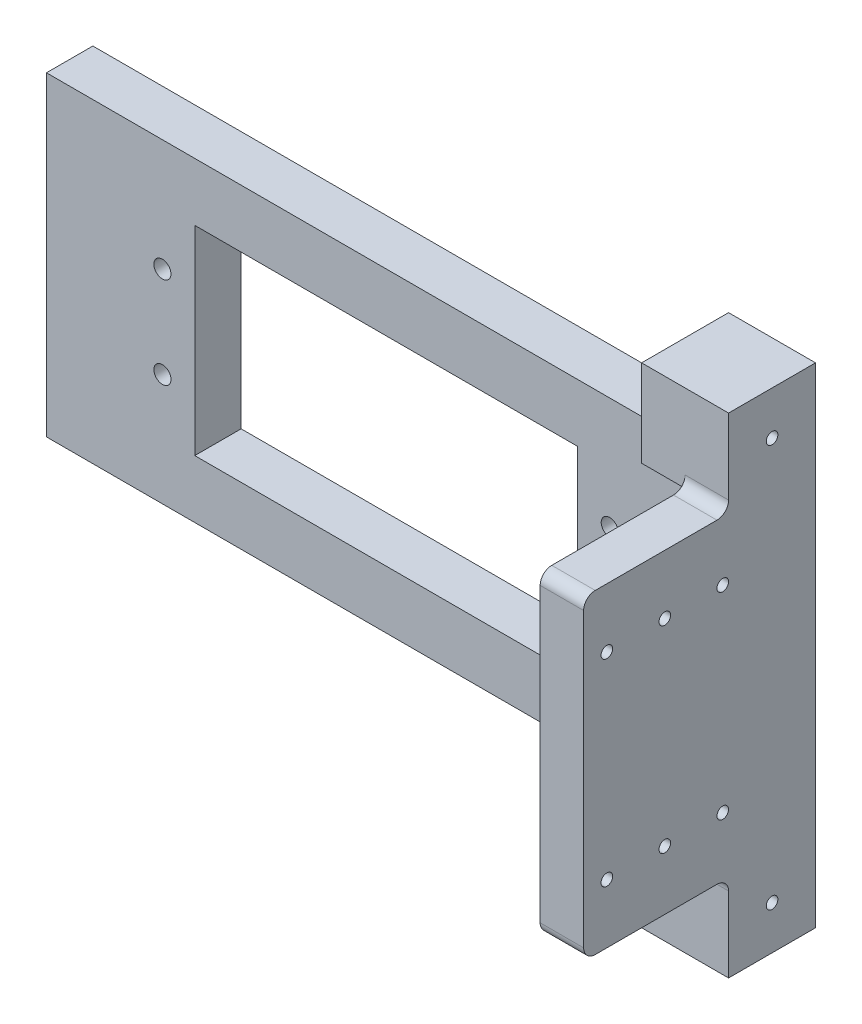
from build123d import *

# Parameters (mm, degrees)
SKETCH1_W            = 54.61
SKETCH1_H            = 47.244
SKETCH1_W_2          = 41.91
SKETCH1_H_2          = 21.844
BOSS_EXTRUDE1_DEPTH  = 5.08
SKETCH2_R            = 0.93599
CUT_EXTRUDE1_DEPTH   = 73.388217522
SKETCH10_W           = 14.41958
SKETCH10_H           = 19.49958
SKETCH10_R           = 0.635
BOSS_EXTRUDE4_DEPTH  = 5.08
SKETCH11_R           = 0.635
SKETCH11_W           = 3.302
SKETCH11_H           = 76.2
BOSS_EXTRUDE5_DEPTH  = 5.08
SKETCH12_W           = 60.452
SKETCH12_H           = 6.35
SKETCH12_W_2         = 59.182
CUT_EXTRUDE2_DEPTH   = 95.448366629
SKETCH13_W           = 7.0195552
SKETCH13_H           = 78.993394517
BOSS_EXTRUDE6_DEPTH  = 4.826
FILLET1_R            = 2.54
CUT_EXTRUDE3_DEPTH   = 95.448366629
SKETCH15_W           = 9.078627065
SKETCH15_H           = 34.544
BOSS_EXTRUDE7_DEPTH  = 5.08
SKETCH19_W           = 25.4
SKETCH19_H           = 34.544
BOSS_EXTRUDE9_DEPTH  = 4.7625
SKETCH20_W           = 9.525
SKETCH20_H           = 9.525
BOSS_EXTRUDE10_DEPTH = 9.525
SKETCH21_R           = 0.635
CUT_EXTRUDE4_DEPTH   = 98.23065776
SKETCH22_R           = 0.635
CUT_EXTRUDE5_DEPTH   = 98.23065776
RIB1_REACH           = 80.493
SKETCH24_WALL_W      = 169.76250031
SKETCH24_WALL_H      = 2.54
FILLET2_R            = 1.27


with BuildPart() as part:
    # Sketch1 → Boss-Extrude1 (new body)
    with BuildSketch(Plane.XY):
        with Locations((27.305, 23.622)):
            Rectangle(SKETCH1_W, SKETCH1_H)
        with Locations((27.305, 23.622)):
            Rectangle(SKETCH1_W_2, SKETCH1_H_2, mode=Mode.SUBTRACT)
    extrude(amount=BOSS_EXTRUDE1_DEPTH)

    # Sketch2 → Cut-Extrude1 (cut, through all)
    with BuildSketch(Plane.XY.offset(5.08)):
        with Locations((2.80543, 28.62199)):
            Circle(SKETCH2_R)
        with Locations((2.80543, 18.62201)):
            Circle(SKETCH2_R)
        with Locations((51.80457, 28.62199)):
            Circle(SKETCH2_R)
        with Locations((51.80457, 18.62201)):
            Circle(SKETCH2_R)
    extrude(amount=-CUT_EXTRUDE1_DEPTH, mode=Mode.SUBTRACT)

    # Sketch10 → Boss-Extrude4 (add)
    with BuildSketch(Plane.XY.offset(5.08)):
        with Locations((61.81979, 23.622)):
            Rectangle(SKETCH10_W, SKETCH10_H)
        with Locations((64.35979, 21.49221)):
            Circle(SKETCH10_R, mode=Mode.SUBTRACT)
        with Locations((64.35979, 25.75179)):
            Circle(SKETCH10_R, mode=Mode.SUBTRACT)
    extrude(amount=-BOSS_EXTRUDE4_DEPTH)

    # Sketch11 → Boss-Extrude5 (add)
    with BuildSketch(Plane.XY.offset(5.08)):
        Polygon((0, 47.244), (-5.842, 47.244), (-5.842, 64.262), (-15.748, 64.262), (-15.748, -17.018), (-4.572, -17.018), (-4.572, 0), (0, 0), align=None)
        with Locations(Location((-4.572, 21.49221, 0), (0, 0, 180))):
            Circle(SKETCH11_R, mode=Mode.SUBTRACT)
        with Locations(Location((-4.572, 25.75179, 0), (0, 0, 180))):
            Circle(SKETCH11_R, mode=Mode.SUBTRACT)
        with Locations((-10.795, 23.622)):
            Rectangle(SKETCH11_W, SKETCH11_H, mode=Mode.SUBTRACT)
    extrude(amount=-BOSS_EXTRUDE5_DEPTH)

    # Sketch12 → Cut-Extrude2 (cut, through all)
    with BuildSketch(Plane.XY.offset(5.08)):
        with Locations((24.384, 44.069)):
            Rectangle(SKETCH12_W, SKETCH12_H)
        with Locations((25.019, 3.175)):
            Rectangle(SKETCH12_W_2, SKETCH12_H)
    extrude(amount=-CUT_EXTRUDE2_DEPTH, mode=Mode.SUBTRACT)

    # Sketch13 → Boss-Extrude6 (add)
    with BuildSketch(Plane(origin=(0, 0, 0), x_dir=(-1, 0, 0), z_dir=(0, 0, -1))):
        with Locations((10.665198327, 23.388014827)):
            Rectangle(SKETCH13_W, SKETCH13_H)
    extrude(amount=-BOSS_EXTRUDE6_DEPTH)

    # Fillet1
    fillet1_edges = [part.edges().sort_by_distance(p)[0] for p in [
        (69.02958, 13.87221, 2.54),
        (54.61, 13.87221, 2.54),
        (54.61, 6.35, 2.54),
        (-4.572, 6.35, 2.54),
        (-4.572, -17.018, 2.54),
        (-15.748, -17.018, 2.54),
        (-15.748, 64.262, 2.54),
        (-5.842, 64.262, 2.54),
        (-5.842, 40.894, 2.54),
        (54.61, 40.894, 2.54),
        (54.61, 33.37179, 2.54),
        (69.02958, 33.37179, 2.54),
    ]]
    fillet(fillet1_edges, radius=FILLET1_R)

    # Sketch14 → Cut-Extrude3 (cut, through all)
    with BuildSketch(Plane.XY.offset(5.08)):
        Polygon((2.80543, 40.894), (-0.815942935, 40.894), (-0.815942935, 6.35), (2.80543, 6.35), (2.80543, -19.941776761), (-23.515321153, -19.941776761), (-23.515321153, 65.826532556), (2.80543, 65.826532556), align=None)
        Polygon((51.80457, 40.896870143), (51.80457, 65.826532556), (74.486186006, 65.826532556), (74.486186006, -19.941776761), (51.80457, -19.941776761), (52.07, 6.35), (54.61, 8.89), (54.61, 38.354), align=None)
    extrude(amount=-CUT_EXTRUDE3_DEPTH, mode=Mode.SUBTRACT)

    # Sketch15 → Boss-Extrude7 (add)
    with BuildSketch(Plane.XY.offset(5.08)):
        with Locations((-5.355256468, 23.622)):
            Rectangle(SKETCH15_W, SKETCH15_H)
        Polygon((51.807736495, 40.894), (54.61, 38.354), (54.61, 8.89), (52.07, 6.35), (64.50457, 6.35), (64.50457, 40.894), align=None)
    extrude(amount=-BOSS_EXTRUDE7_DEPTH)

    # Sketch19 → Boss-Extrude9 (add)
    with BuildSketch(Plane(origin=(64.50457, 0, 0), x_dir=(0, 0, -1), z_dir=(1, 0, 0))):
        with Locations((-12.7, 23.622)):
            Rectangle(SKETCH19_W, SKETCH19_H)
    extrude(amount=BOSS_EXTRUDE9_DEPTH)

    # Sketch20 → Boss-Extrude10 (add)
    with BuildSketch(Plane(origin=(69.26707, 0, 0), x_dir=(0, 0, -1), z_dir=(1, 0, 0))):
        with Locations((-4.7625, 45.6565)):
            Rectangle(SKETCH20_W, SKETCH20_H)
        with Locations((-4.7625, 1.5875)):
            Rectangle(SKETCH20_W, SKETCH20_H)
    extrude(amount=-BOSS_EXTRUDE10_DEPTH)

    # Sketch21 → Cut-Extrude4 (cut, through all)
    with BuildSketch(Plane(origin=(69.26707, 0, 0), x_dir=(0, 0, -1), z_dir=(1, 0, 0))):
        with Locations((-4.7625, 45.6565)):
            Circle(SKETCH21_R)
        with Locations((-4.7625, 1.5875)):
            Circle(SKETCH21_R)
    extrude(amount=-CUT_EXTRUDE4_DEPTH, mode=Mode.SUBTRACT)

    # Sketch22 → Cut-Extrude5 (cut, through all)
    with BuildSketch(Plane(origin=(69.26707, 0, 0), x_dir=(0, 0, -1), z_dir=(1, 0, 0))):
        with Locations((-22.86, 34.417)):
            Circle(SKETCH22_R)
        with Locations((-22.86, 12.827)):
            Circle(SKETCH22_R)
        with Locations((-16.51, 34.417)):
            Circle(SKETCH22_R)
        with Locations((-10.16, 34.417)):
            Circle(SKETCH22_R)
        with Locations((-10.16, 12.827)):
            Circle(SKETCH22_R)
        with Locations((-16.51, 12.827)):
            Circle(SKETCH22_R)
    extrude(amount=-CUT_EXTRUDE5_DEPTH, mode=Mode.SUBTRACT)

    # Sketch24 wall → Rib1 (add, up to next)
    with BuildSketch(Plane(origin=(60.69457, 23.622, 8.89), x_dir=(-0.707106781187, 0, -0.707106781187), z_dir=(0.707106781187, 0, -0.707106781187)), mode=Mode.PRIVATE) as rib1_sk1:
        Rectangle(SKETCH24_WALL_W, SKETCH24_WALL_H)
    rib1_tool1 = extrude(rib1_sk1.sketch, amount=RIB1_REACH, mode=Mode.PRIVATE) - part.part
    add(rib1_tool1.solids().sort_by_distance((60.69457, 23.622, 8.89))[0])

    # Fillet2
    fillet2_edges = [part.edges().sort_by_distance(p)[0] for p in [
        (62.12332, 6.35, 5.08),
        (64.50457, 14.351, 5.08),
        (66.88582, 40.894, 25.4),
        (66.88582, 6.35, 25.4),
        (62.12332, 40.894, 5.08),
        (66.88582, 40.894, 9.525),
        (66.88582, 6.35, 9.525),
        (64.50457, 32.893, 5.08),
        (64.50457, 23.622, 12.7),
        (56.88457, 23.622, 5.08),
        (60.69457, 22.352, 5.08),
        (60.69457, 24.892, 5.08),
    ]]
    fillet(fillet2_edges, radius=FILLET2_R)


solid = part.part
